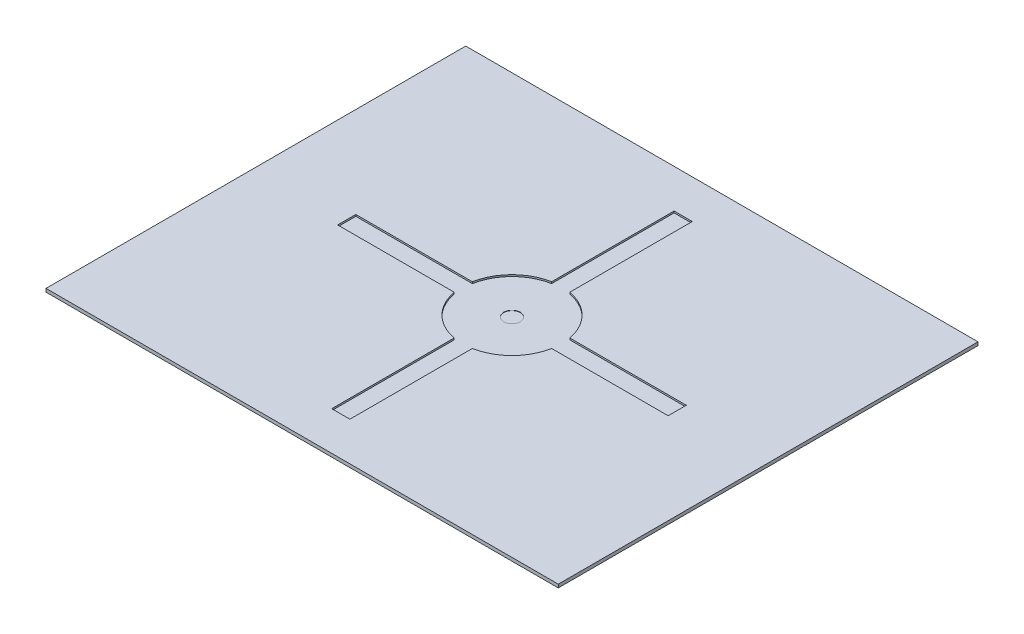
from build123d import *

# Parameters (mm, degrees)
SKETCH1_W           = 155
SKETCH1_H           = 127
BOSS_EXTRUDE1_DEPTH = 1
CUT_EXTRUDE1_DEPTH  = 0.5
SKETCH3_R           = 2.5
CUT_EXTRUDE2_DEPTH  = 0.1


with BuildPart() as part:
    # Sketch1 → Boss-Extrude1 (new body)
    with BuildSketch(Plane(origin=(0, 0, 0), x_dir=(1, 0, 0), z_dir=(0, 1, 0))):
        Rectangle(SKETCH1_W, SKETCH1_H)
    extrude(amount=BOSS_EXTRUDE1_DEPTH)

    # Sketch2 → Cut-Extrude1 (cut)
    with BuildSketch(Plane(origin=(0, 1, 0), x_dir=(1, 0, 0), z_dir=(0, 1, 0))):
        with BuildLine():
            Line((2.75, -14.745762103), (2.75, -51.798849897))
            Line((2.75, -51.798849897), (-2.75, -51.798849897))
            Line((-2.75, -51.798849897), (-2.75, -14.745762103))
            ThreePointArc((-2.75, -14.745762103), (-10.606601718, -10.606601718), (-14.745762103, -2.75))
            Line((-14.745762103, -2.75), (-50, -2.75))
            Line((-50, -2.75), (-50, 2.75))
            Line((-50, 2.75), (-14.745762103, 2.75))
            ThreePointArc((-14.745762103, 2.75), (-10.606601718, 10.606601718), (-2.75, 14.745762103))
            Line((-2.75, 14.745762103), (-2.75, 51.798849897))
            Line((-2.75, 51.798849897), (2.75, 51.798849897))
            Line((2.75, 51.798849897), (2.75, 14.745762103))
            ThreePointArc((2.75, 14.745762103), (10.606601718, 10.606601718), (14.745762103, 2.75))
            Line((14.745762103, 2.75), (50, 2.75))
            Line((50, 2.75), (50, -2.75))
            Line((50, -2.75), (14.745762103, -2.75))
            ThreePointArc((14.745762103, -2.75), (10.606601718, -10.606601718), (2.75, -14.745762103))
        make_face()
    extrude(amount=-CUT_EXTRUDE1_DEPTH, mode=Mode.SUBTRACT)

    # Sketch3 → Cut-Extrude2 (cut)
    with BuildSketch(Plane(origin=(0, 0.5, 0), x_dir=(1, 0, 0), z_dir=(0, 1, 0))):
        with Locations(Location((0, 0, 0), (0, 0, 270))):
            Circle(SKETCH3_R)
    extrude(amount=-CUT_EXTRUDE2_DEPTH, mode=Mode.SUBTRACT)


solid = part.part
